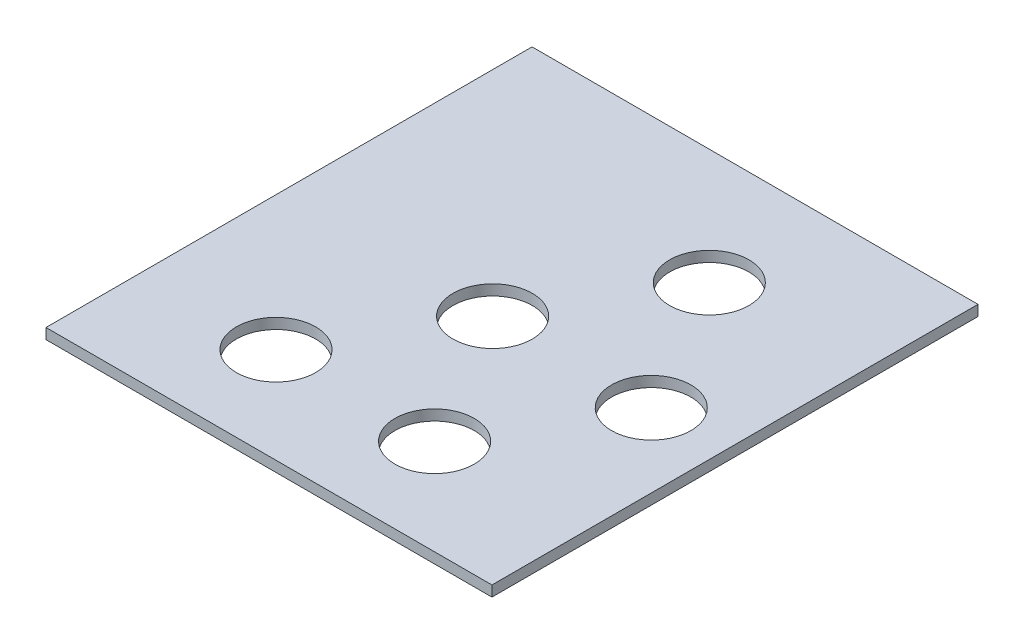
from build123d import *

# Parameters (mm, degrees)
SKETCH1_W           = 67.483781856
SKETCH1_H           = 73.550078875
SKETCH1_R           = 6
BOSS_EXTRUDE1_DEPTH = 1.6


with BuildPart() as part:
    # Sketch1 → Boss-Extrude1 (new body)
    with BuildSketch(Plane(origin=(0, 0, 0), x_dir=(1, 0, 0), z_dir=(0, 1, 0))):
        with Locations((1.426908435, 15.357803953)):
            Rectangle(SKETCH1_W, SKETCH1_H)
        with Locations(Location((0, 13.856406461, 0), (0, 0, 270))):
            Circle(SKETCH1_R, mode=Mode.SUBTRACT)
        with Locations(Location((24, 13.856406461, 0), (0, 0, 270))):
            Circle(SKETCH1_R, mode=Mode.SUBTRACT)
        with Locations(Location((12, -6.92820323, 0), (0, 0, 270))):
            Circle(SKETCH1_R, mode=Mode.SUBTRACT)
        with Locations(Location((-12, -6.92820323, 0), (0, 0, 270))):
            Circle(SKETCH1_R, mode=Mode.SUBTRACT)
        with Locations(Location((12, 34.641016151, 0), (0, 0, 270))):
            Circle(SKETCH1_R, mode=Mode.SUBTRACT)
    extrude(amount=BOSS_EXTRUDE1_DEPTH)


solid = part.part
